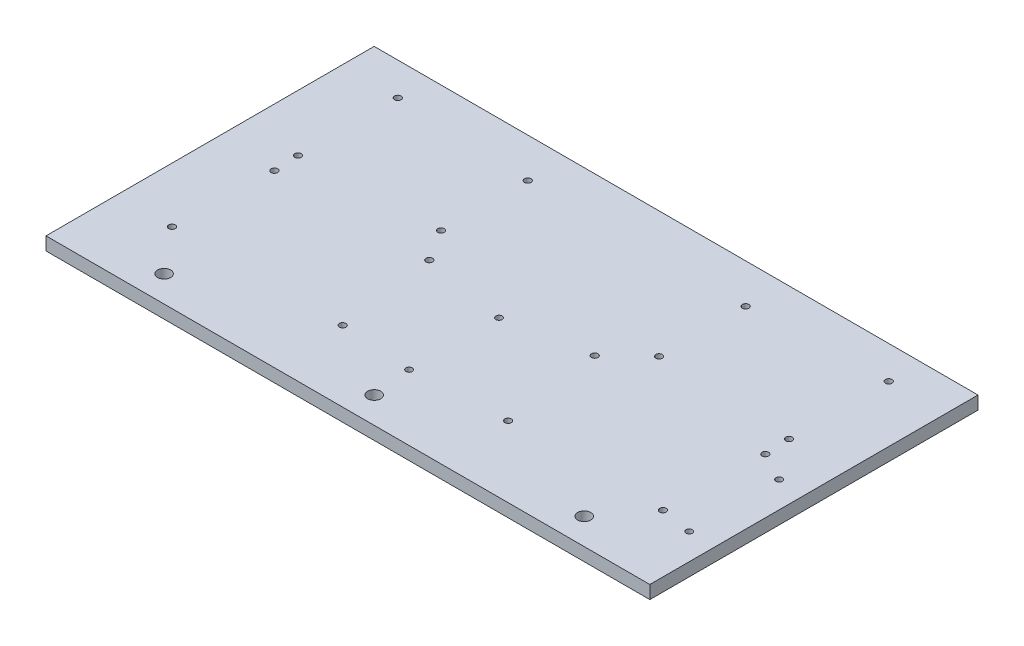
from build123d import *

# Parameters (mm, degrees)
SKETCH1_W           = 292.1
SKETCH1_H           = 158.75
BOSS_EXTRUDE1_DEPTH = 6.35
SKETCH2_R           = 3.175
CUT_EXTRUDE2_DEPTH  = 6.35
SKETCH4_R           = 1.5875
CUT_EXTRUDE3_DEPTH  = 333.512097524
SKETCH5_R           = 1.525
CUT_EXTRUDE4_DEPTH  = 333.512097524


with BuildPart() as part:
    # Sketch1 → Boss-Extrude1 (new body)
    with BuildSketch(Plane(origin=(0, 0, 0), x_dir=(1, 0, 0), z_dir=(0, 1, 0))):
        with Locations((146.05, 79.375)):
            Rectangle(SKETCH1_W, SKETCH1_H)
    extrude(amount=BOSS_EXTRUDE1_DEPTH)

    # Sketch2 → Cut-Extrude2 (cut)
    with BuildSketch(Plane(origin=(0, 6.35, 0), x_dir=(1, 0, 0), z_dir=(0, 1, 0))):
        with Locations(Location((146.05, 12.7, 0), (0, 0, 270))):
            Circle(SKETCH2_R)
        with Locations(Location((247.65, 12.7, 0), (0, 0, 270))):
            Circle(SKETCH2_R)
        with Locations(Location((44.45, 12.7, 0), (0, 0, 270))):
            Circle(SKETCH2_R)
    extrude(amount=-CUT_EXTRUDE2_DEPTH, mode=Mode.SUBTRACT)

    # Sketch4 → Cut-Extrude3 (cut, through all)
    with BuildSketch(Plane(origin=(0, 6.35, 0), x_dir=(1, 0, 0), z_dir=(0, 1, 0))):
        with Locations(Location((182.88, 82.55, 0), (0, 0, 270))):
            Circle(SKETCH4_R)
        with Locations(Location((189.23, 34.29, 0), (0, 0, 270))):
            Circle(SKETCH4_R)
        with Locations(Location((265.43, 82.55, 0), (0, 0, 270))):
            Circle(SKETCH4_R)
        with Locations(Location((264.16, 34.29, 0), (0, 0, 270))):
            Circle(SKETCH4_R)
        with Locations(Location((264.795, 142.875, 0), (0, 0, 270))):
            Circle(SKETCH4_R)
        with Locations(Location((264.795, 94.615, 0), (0, 0, 270))):
            Circle(SKETCH4_R)
        with Locations(Location((198.755, 97.79, 0), (0, 0, 270))):
            Circle(SKETCH4_R)
        with Locations(Location((198.755, 139.7, 0), (0, 0, 270))):
            Circle(SKETCH4_R)
        with Locations(Location((102.87, 82.55, 0), (0, 0, 270))):
            Circle(SKETCH4_R)
        with Locations(Location((109.22, 34.29, 0), (0, 0, 270))):
            Circle(SKETCH4_R)
        with Locations(Location((26.67, 34.29, 0), (0, 0, 270))):
            Circle(SKETCH4_R)
        with Locations(Location((27.94, 82.55, 0), (0, 0, 270))):
            Circle(SKETCH4_R)
        with Locations(Location((93.345, 139.7, 0), (0, 0, 270))):
            Circle(SKETCH4_R)
        with Locations(Location((93.345, 97.79, 0), (0, 0, 270))):
            Circle(SKETCH4_R)
        with Locations(Location((27.305, 142.875, 0), (0, 0, 270))):
            Circle(SKETCH4_R)
        with Locations(Location((27.305, 94.615, 0), (0, 0, 270))):
            Circle(SKETCH4_R)
    extrude(amount=-CUT_EXTRUDE3_DEPTH, mode=Mode.SUBTRACT)

    # Sketch5 → Cut-Extrude4 (cut, through all)
    with BuildSketch(Plane(origin=(0, 6.35, 0), x_dir=(1, 0, 0), z_dir=(0, 1, 0))):
        with Locations(Location((279.4, 31.75, 0), (0, 0, 270))):
            Circle(SKETCH5_R)
        with Locations(Location((279.4, 75.25, 0), (0, 0, 270))):
            Circle(SKETCH5_R)
        with Locations(Location((143.9, 75.25, 0), (0, 0, 270))):
            Circle(SKETCH5_R)
        with Locations(Location((143.9, 31.75, 0), (0, 0, 270))):
            Circle(SKETCH5_R)
    extrude(amount=-CUT_EXTRUDE4_DEPTH, mode=Mode.SUBTRACT)


solid = part.part
